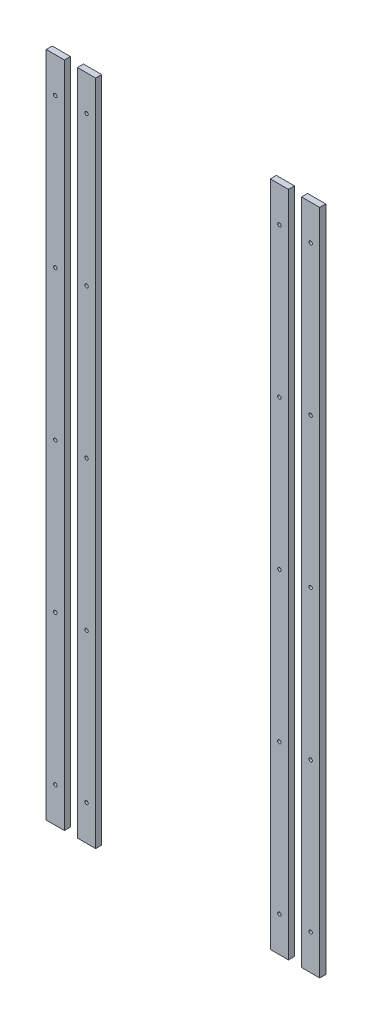
from build123d import *

# Parameters (mm, degrees)
SKETCH_1760_W          = 18
SKETCH_1760_H          = 662
EXTRUDE_6_DEPTH        = 6
EXTRUDE_6_2_DEPTH      = 6
EXTRUDE_6_3_DEPTH      = 6
EXTRUDE_6_4_DEPTH      = 6
SKETCH_3_R             = 1.7
CUT_EXTRUDE_3_DEPTH    = 726.74047703
PATTERN_LINEAR_5_COUNT = 5
PATTERN_LINEAR_5_PITCH = 148


with BuildPart() as part:
    # Sketch 1760 → Четыре_направляющие_6мм (new body)
    with BuildSketch(Plane.XY):
        with Locations((324.5, -96)):
            Rectangle(SKETCH_1760_W, SKETCH_1760_H)
    extrude(amount=EXTRUDE_6_DEPTH)


with BuildPart() as body_2:
    # Sketch 1760 → Extrude 6 2 (new body)
    with BuildSketch(Plane.XY):
        with Locations((355.5, -96)):
            Rectangle(SKETCH_1760_W, SKETCH_1760_H)
    extrude(amount=EXTRUDE_6_2_DEPTH)


with BuildPart() as body_3:
    # Sketch 1760 → Extrude 6 3 (new body)
    with BuildSketch(Plane.XY):
        with Locations((546.8, -96)):
            Rectangle(SKETCH_1760_W, SKETCH_1760_H)
    extrude(amount=EXTRUDE_6_3_DEPTH)


with BuildPart() as body_4:
    # Sketch 1760 → Extrude 6 4 (new body)
    with BuildSketch(Plane.XY):
        with Locations((577.8, -96)):
            Rectangle(SKETCH_1760_W, SKETCH_1760_H)
    extrude(amount=EXTRUDE_6_4_DEPTH)


with BuildPart() as cut_extrude_3_tool:
    # Крепление_направляющих_М3_эскиз → Проходы_направляющих_М3 (new, symmetric)
    with BuildSketch(Plane.XY):
        with Locations((324.5, -392)):
            Circle(SKETCH_3_R)
        with Locations((355.5, -392)):
            Circle(SKETCH_3_R)
        with Locations((546.8, -392)):
            Circle(SKETCH_3_R)
        with Locations((577.8, -392)):
            Circle(SKETCH_3_R)
    cut_extrude_3 = extrude(amount=CUT_EXTRUDE_3_DEPTH, both=True)


with BuildPart() as part_1:
    add(part.part)

    # Проходы_направляющих_М3: cut by cut_extrude_3_tool
    add(cut_extrude_3_tool.part, mode=Mode.SUBTRACT)


with BuildPart() as body_2_1:
    add(body_2.part)

    # Проходы_направляющих_М3: cut by cut_extrude_3_tool
    add(cut_extrude_3_tool.part, mode=Mode.SUBTRACT)


with BuildPart() as body_3_1:
    add(body_3.part)

    # Проходы_направляющих_М3: cut by cut_extrude_3_tool
    add(cut_extrude_3_tool.part, mode=Mode.SUBTRACT)


with BuildPart() as body_4_1:
    add(body_4.part)

    # Проходы_направляющих_М3: cut by cut_extrude_3_tool
    add(cut_extrude_3_tool.part, mode=Mode.SUBTRACT)


with BuildPart() as pattern_linear_5_tool:
    # Массив_крепления_направляющих_5рядов: Проходы_направляющих_М3 ×5
    with Locations(*[(0, i * PATTERN_LINEAR_5_PITCH, 0) for i in range(1, PATTERN_LINEAR_5_COUNT)]):
        add(cut_extrude_3)


with BuildPart() as part_2:
    add(part_1.part)

    # Массив_крепления_направляющих_5рядов: cut by pattern_linear_5_tool
    add(pattern_linear_5_tool.part, mode=Mode.SUBTRACT)


with BuildPart() as body_2_2:
    add(body_2_1.part)

    # Массив_крепления_направляющих_5рядов: cut by pattern_linear_5_tool
    add(pattern_linear_5_tool.part, mode=Mode.SUBTRACT)


with BuildPart() as body_3_2:
    add(body_3_1.part)

    # Массив_крепления_направляющих_5рядов: cut by pattern_linear_5_tool
    add(pattern_linear_5_tool.part, mode=Mode.SUBTRACT)


with BuildPart() as body_4_2:
    add(body_4_1.part)

    # Массив_крепления_направляющих_5рядов: cut by pattern_linear_5_tool
    add(pattern_linear_5_tool.part, mode=Mode.SUBTRACT)


solid = Compound([part_2.part, body_2_2.part, body_3_2.part, body_4_2.part])
